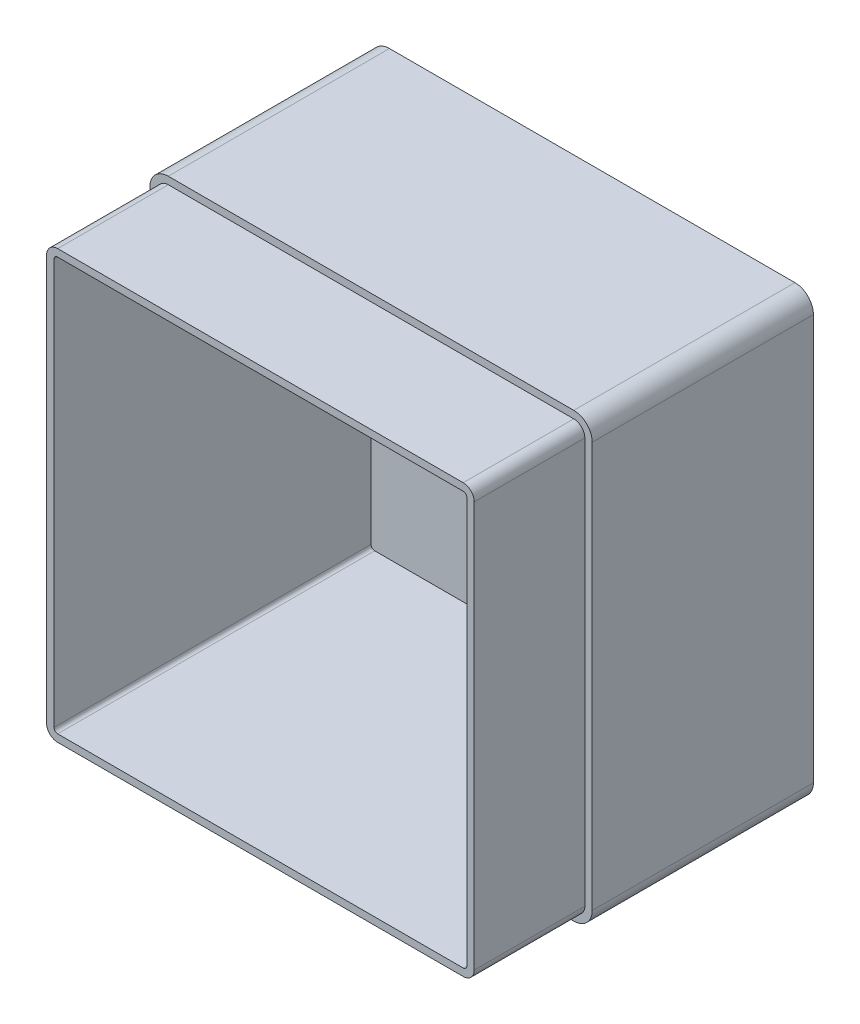
from build123d import *

# Parameters (mm, degrees)
SKETCH1_W           = 120
SKETCH1_H           = 120
BOSS_EXTRUDE1_DEPTH = 90
FILLET1_R           = 5
SHELL1_T            = -4
CUT_EXTRUDE1_DEPTH  = 30


with BuildPart() as part:
    # Sketch1 → Boss-Extrude1 (new body)
    with BuildSketch(Plane.XY):
        Rectangle(SKETCH1_W, SKETCH1_H)
    extrude(amount=BOSS_EXTRUDE1_DEPTH)

    # Fillet1
    fillet1_edges = [part.edges().sort_by_distance(p)[0] for p in [
        (60, -60, 45),
        (-60, -60, 45),
        (-60, 60, 45),
        (60, 60, 45),
    ]]
    fillet(fillet1_edges, radius=FILLET1_R)

    # Shell1
    shell1_openings = [part.faces().sort_by_distance(p)[0] for p in [
        (0, 0, 90),
    ]]
    offset(amount=SHELL1_T, openings=shell1_openings, kind=Kind.INTERSECTION)

    # Sketch2 → Cut-Extrude1 (cut)
    with BuildSketch(Plane.XY.offset(90)):
        with BuildLine():
            Line((-55, -60), (55, -60))
            ThreePointArc((55, -60), (58.535533906, -58.535533906), (60, -55))
            Line((60, -55), (60, 55))
            ThreePointArc((60, 55), (58.535533906, 58.535533906), (55, 60))
            Line((55, 60), (-55, 60))
            ThreePointArc((-55, 60), (-58.535533906, 58.535533906), (-60, 55))
            Line((-60, 55), (-60, -55))
            ThreePointArc((-60, -55), (-58.535533906, -58.535533906), (-55, -60))
        make_face()
        with BuildLine():
            Line((55, 58), (-55, 58))
            ThreePointArc((-55, 58), (-57.121320344, 57.121320344), (-58, 55))
            Line((-58, 55), (-58, -55))
            ThreePointArc((-58, -55), (-57.121320344, -57.121320344), (-55, -58))
            Line((-55, -58), (55, -58))
            ThreePointArc((55, -58), (57.121320344, -57.121320344), (58, -55))
            Line((58, -55), (58, 55))
            ThreePointArc((58, 55), (57.121320344, 57.121320344), (55, 58))
        make_face(mode=Mode.SUBTRACT)
    extrude(amount=-CUT_EXTRUDE1_DEPTH, mode=Mode.SUBTRACT)


solid = part.part
